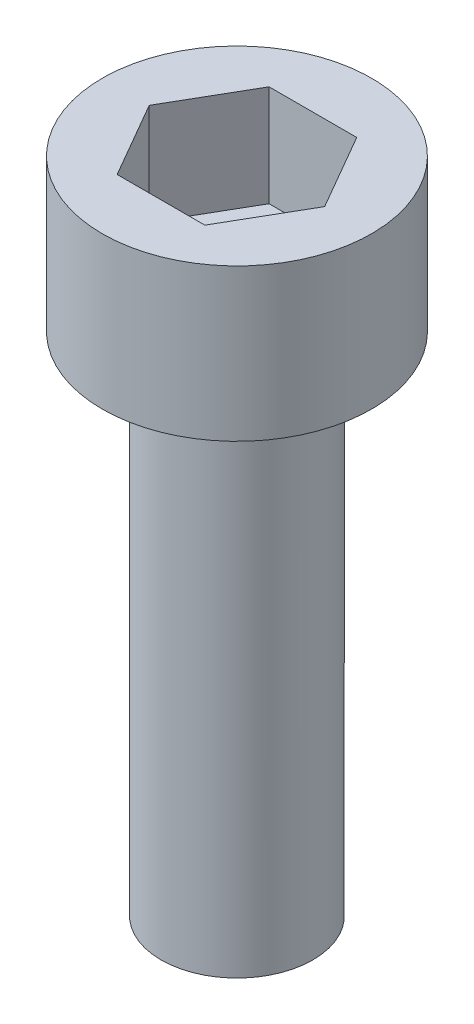
from build123d import *

# Parameters (mm, degrees)
SKETCH1_R           = 2.66
BOSS_EXTRUDE1_DEPTH = 3
CUT_EXTRUDE1_DEPTH  = 2
SKETCH3_R           = 1.5
BOSS_EXTRUDE2_DEPTH = 10


with BuildPart() as part:
    # Sketch1 → Boss-Extrude1 (new body)
    with BuildSketch(Plane(origin=(0, 0, 0), x_dir=(1, 0, 0), z_dir=(0, 1, 0))):
        with Locations(Location((0, 0, 0), (0, 0, 270))):
            Circle(SKETCH1_R)
    extrude(amount=BOSS_EXTRUDE1_DEPTH)

    # Sketch2 → Cut-Extrude1 (cut)
    with BuildSketch(Plane(origin=(0, 3, 0), x_dir=(1, 0, 0), z_dir=(0, 1, 0))):
        Polygon((1.732050808, 0), (0.866025404, 1.5), (-0.866025404, 1.5), (-1.732050808, 0), (-0.866025404, -1.5), (0.866025404, -1.5), align=None)
    extrude(amount=-CUT_EXTRUDE1_DEPTH, mode=Mode.SUBTRACT)

    # Sketch3 → Boss-Extrude2 (add)
    with BuildSketch(Plane.XZ):
        with Locations(Location((0, 0, 0), (0, 0, 90))):
            Circle(SKETCH3_R)
    extrude(amount=BOSS_EXTRUDE2_DEPTH)


solid = part.part
